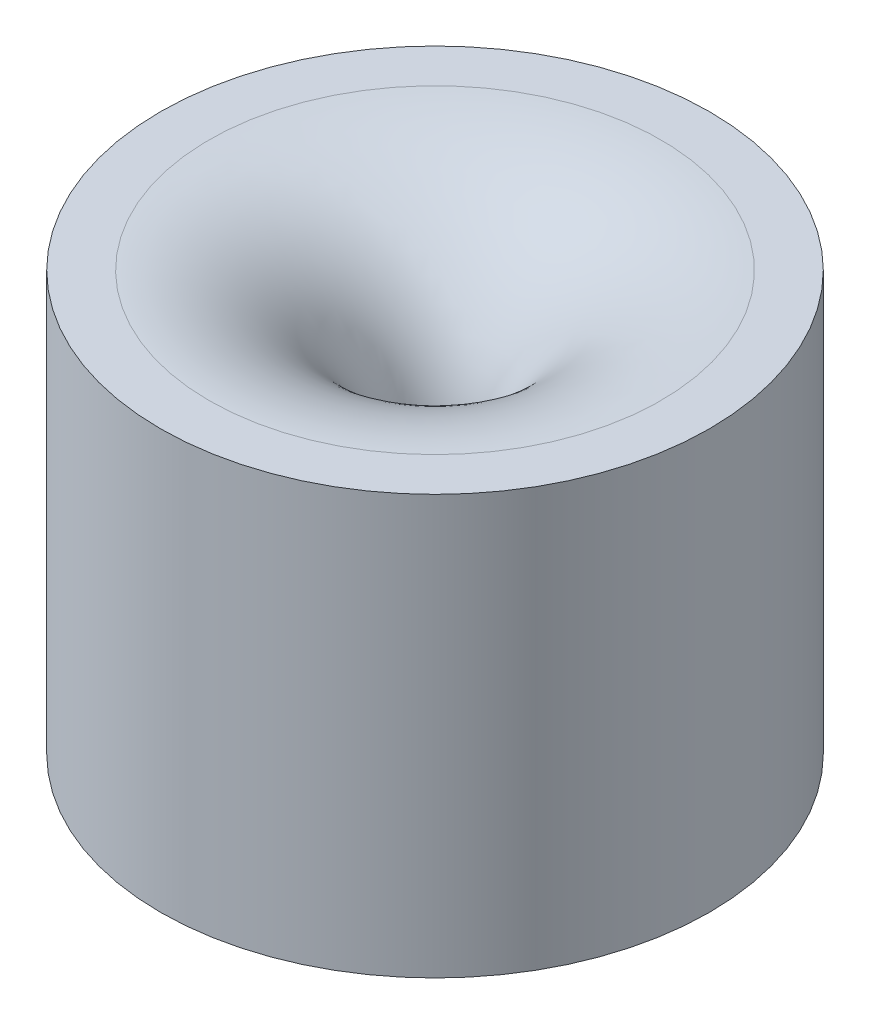
from build123d import *

# Parameters (mm, degrees)
SKETCH1_R           = 29.175
SKETCH1_R_2         = 4
BOSS_EXTRUDE1_DEPTH = 44.5
FILLET1_R           = 20
SKETCH2_R           = 11
CUT_EXTRUDE1_DEPTH  = 10


with BuildPart() as part:
    # Sketch1 → Boss-Extrude1 (new body)
    with BuildSketch(Plane(origin=(0, 0, 0), x_dir=(1, 0, 0), z_dir=(0, 1, 0))):
        with Locations(Location((0, 0, 0), (0, 0, 270))):
            Circle(SKETCH1_R)
        with Locations(Location((0, 0, 0), (0, 0, 270))):
            Circle(SKETCH1_R_2, mode=Mode.SUBTRACT)
    extrude(amount=BOSS_EXTRUDE1_DEPTH)

    # Fillet1
    fillet1_edges = [part.edges().sort_by_distance(p)[0] for p in [
        (0, 44.5, -4),
    ]]
    fillet(fillet1_edges, radius=FILLET1_R)

    # Sketch2 → Cut-Extrude1 (cut)
    with BuildSketch(Plane.XZ):
        with Locations(Location((0, 0, 0), (0, 0, 270))):
            Circle(SKETCH2_R)
    extrude(amount=-CUT_EXTRUDE1_DEPTH, mode=Mode.SUBTRACT)


solid = part.part
